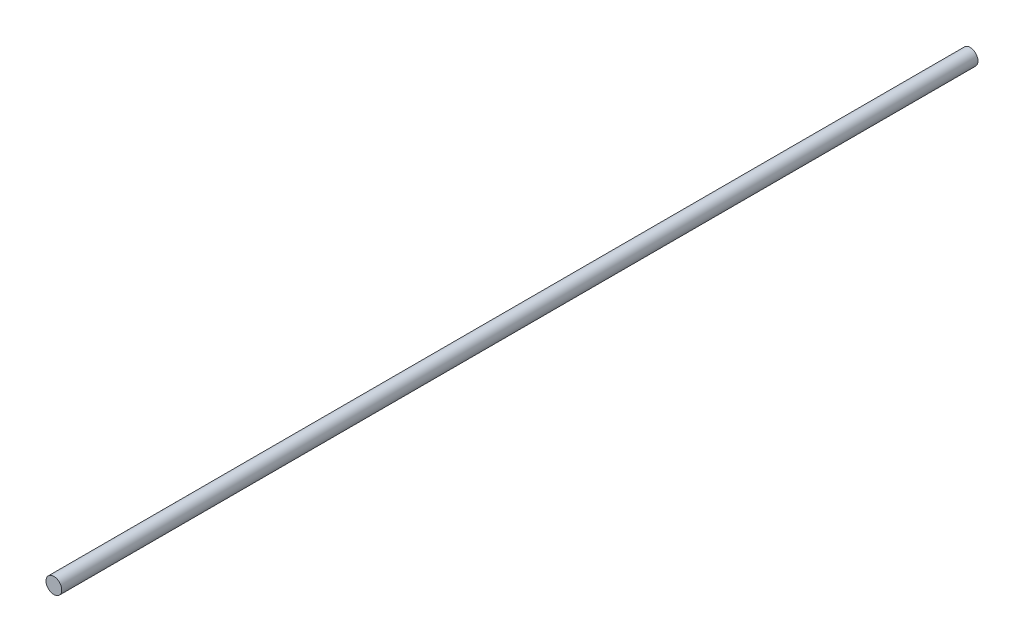
from build123d import *

# Parameters (mm, degrees)
SKETCH1_R           = 3.175
BOSS_EXTRUDE1_DEPTH = 368.809233064


with BuildPart() as part:
    # Sketch1 → Boss-Extrude1 (new body)
    with BuildSketch(Plane.XY):
        Circle(SKETCH1_R)
    extrude(amount=BOSS_EXTRUDE1_DEPTH)


solid = part.part
